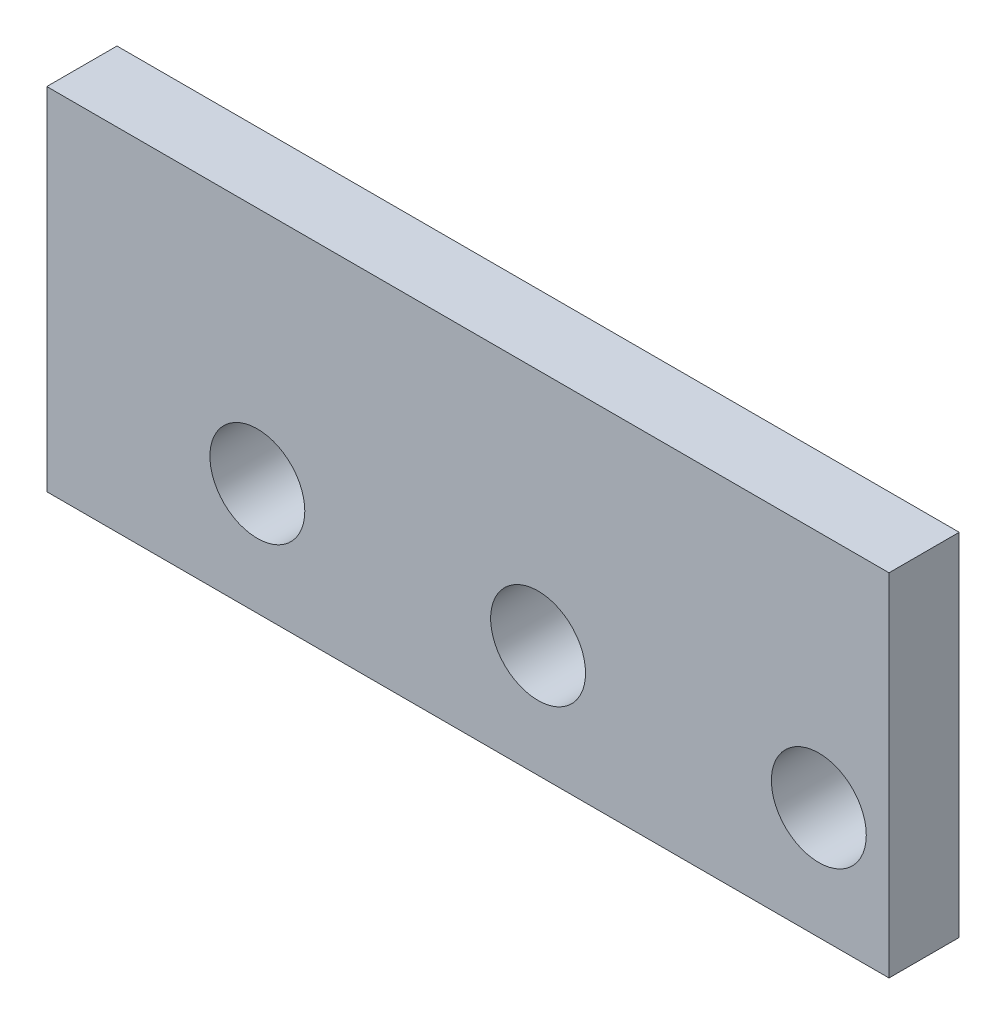
from build123d import *

# Parameters (mm, degrees)
SKETCH1_W           = 38.1
SKETCH1_H           = 15.875
SKETCH1_R           = 2.1463
BOSS_EXTRUDE1_DEPTH = 3.175


with BuildPart() as part:
    # Sketch1 → Boss-Extrude1 (new body)
    with BuildSketch(Plane.XY):
        with Locations((19.05, 7.9375)):
            Rectangle(SKETCH1_W, SKETCH1_H)
        with Locations((9.525, 5.08)):
            Circle(SKETCH1_R, mode=Mode.SUBTRACT)
        with Locations((22.225, 5.08)):
            Circle(SKETCH1_R, mode=Mode.SUBTRACT)
        with Locations((34.925, 5.08)):
            Circle(SKETCH1_R, mode=Mode.SUBTRACT)
    extrude(amount=BOSS_EXTRUDE1_DEPTH)


solid = part.part
